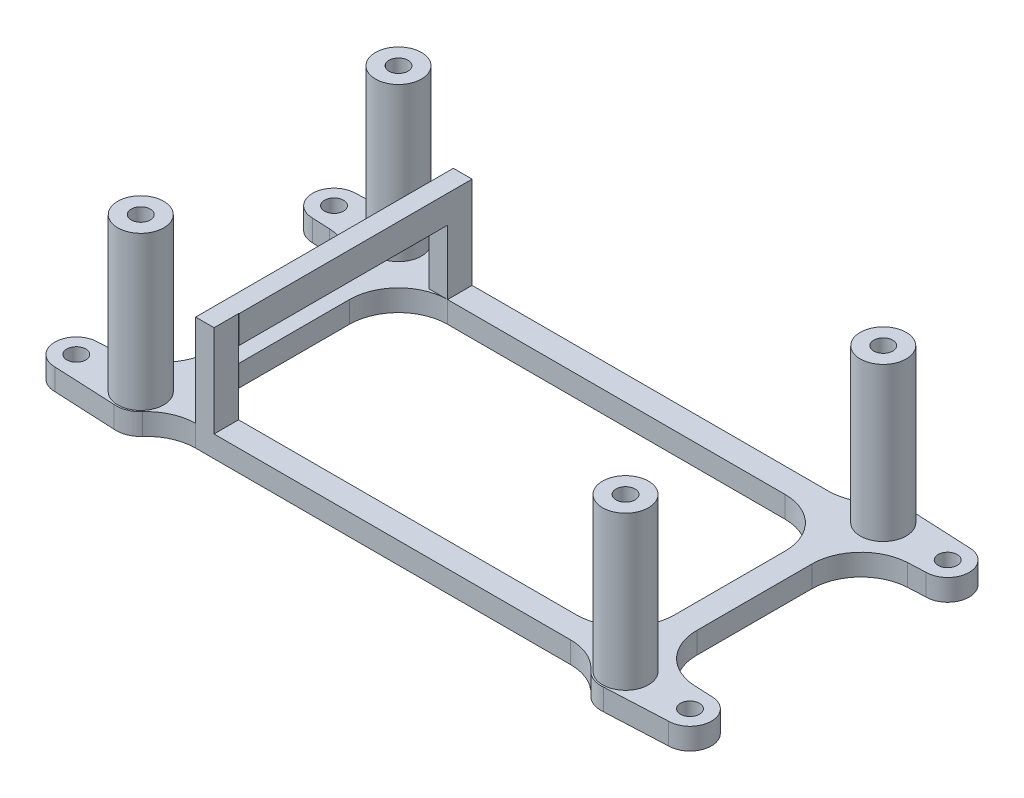
from build123d import *

# Parameters (mm, degrees)
SKETCH10_W              = 71
SKETCH10_H              = 34
BOSS_EXTRUDE6_DEPTH     = 3.5
SKETCH11_R              = 1.55
CUT_EXTRUDE6_DEPTH      = 3.5
SKETCH12_R              = 2.75
CUT_EXTRUDE7_DEPTH      = 3.5
SKETCH13_R              = 3.75
BOSS_EXTRUDE7_DEPTH     = 25
CUT_EXTRUDE8_DEPTH      = 108.597630085
CUT_EXTRUDE8_DEPTH_BACK = 108.597630085
SKETCH14_R              = 1.55
FILLET6_R               = 8
FILLET7_R               = 8
SKETCH16_W              = 3
SKETCH16_H              = 4
SKETCH16_W_2            = 3.05572809
BOSS_EXTRUDE10_DEPTH    = 15
SKETCH18_W              = 3.05572809
SKETCH18_H              = 4.5
BOSS_EXTRUDE11_DEPTH    = 34


with BuildPart() as part:
    # Sketch10 → Boss-Extrude6 (new body)
    with BuildSketch(Plane(origin=(0, 0, 0), x_dir=(1, 0, 0), z_dir=(0, 1, 0))):
        with BuildLine():
            Line((0, -4), (0, -38))
            ThreePointArc((0, -38), (-0.190260598, -38.004527449), (-0.380090498, -38.018099548))
            Line((-0.380090498, -38.018099548), (-10.5, -38.5))
            ThreePointArc((-10.5, -38.5), (-14, -42), (-10.5, -45.5))
            Line((-10.5, -45.5), (-0.380090498, -45.981900452))
            ThreePointArc((-0.380090498, -45.981900452), (2.690691176, -44.959760294), (4, -42))
            Line((4, -42), (75, -42))
            ThreePointArc((75, -42), (76.309308824, -44.959760294), (79.380090498, -45.981900452))
            Line((79.380090498, -45.981900452), (89.5, -45.5))
            ThreePointArc((89.5, -45.5), (93, -42), (89.5, -38.5))
            Line((89.5, -38.5), (79.380090498, -38.018099548))
            ThreePointArc((79.380090498, -38.018099548), (79.190260598, -38.004527449), (79, -38))
            Line((79, -38), (79, -4))
            Line((79, -4), (89.5, -3.5))
            ThreePointArc((89.5, -3.5), (93, 0), (89.5, 3.5))
            Line((89.5, 3.5), (79, 4))
            ThreePointArc((79, 4), (76.171572875, 2.828427125), (75, 0))
            Line((75, 0), (4, 0))
            ThreePointArc((4, 0), (2.828427125, 2.828427125), (0, 4))
            Line((0, 4), (-10.5, 3.5))
            ThreePointArc((-10.5, 3.5), (-14, 0), (-10.5, -3.5))
            Line((-10.5, -3.5), (0, -4))
        make_face()
        with Locations((39.5, -21)):
            Rectangle(SKETCH10_W, SKETCH10_H, mode=Mode.SUBTRACT)
    extrude(amount=BOSS_EXTRUDE6_DEPTH)

    # Sketch11 → Cut-Extrude6 (cut)
    with BuildSketch(Plane(origin=(0, 3.5, 0), x_dir=(1, 0, 0), z_dir=(0, 1, 0))):
        with Locations(Location((0, 0, 0), (0, 0, 270))):
            Circle(SKETCH11_R)
        with Locations(Location((79, 0, 0), (0, 0, 270))):
            Circle(SKETCH11_R)
        with Locations(Location((79, -42, 0), (0, 0, 270))):
            Circle(SKETCH11_R)
        with Locations(Location((0, -42, 0), (0, 0, 270))):
            Circle(SKETCH11_R)
        with Locations(Location((-10.5, -42, 0), (0, 0, 270))):
            Circle(SKETCH11_R)
        with Locations(Location((-10.5, 0, 0), (0, 0, 270))):
            Circle(SKETCH11_R)
        with Locations(Location((89.5, 0, 0), (0, 0, 270))):
            Circle(SKETCH11_R)
        with Locations(Location((89.5, -42, 0), (0, 0, 270))):
            Circle(SKETCH11_R)
    extrude(amount=-CUT_EXTRUDE6_DEPTH, mode=Mode.SUBTRACT)

    # Sketch12 → Cut-Extrude7 (cut)
    with BuildSketch(Plane.XZ):
        with Locations(Location((0, 42, 0), (0, 0, 270))):
            Circle(SKETCH12_R)
        with Locations(Location((79, 42, 0), (0, 0, 270))):
            Circle(SKETCH12_R)
        with Locations(Location((79, 0, 0), (0, 0, 270))):
            Circle(SKETCH12_R)
        with Locations(Location((0, 0, 0), (0, 0, 270))):
            Circle(SKETCH12_R)
    extrude(amount=-CUT_EXTRUDE7_DEPTH, mode=Mode.SUBTRACT)

    # Sketch13 → Boss-Extrude7 (add)
    with BuildSketch(Plane(origin=(0, 3.5, 0), x_dir=(1, 0, 0), z_dir=(0, 1, 0))):
        with Locations(Location((0, 0, 0), (0, 0, 270))):
            Circle(SKETCH13_R)
        with Locations(Location((79, 0, 0), (0, 0, 270))):
            Circle(SKETCH13_R)
        with Locations(Location((79, -42, 0), (0, 0, 270))):
            Circle(SKETCH13_R)
        with Locations(Location((0, -42, 0), (0, 0, 270))):
            Circle(SKETCH13_R)
    extrude(amount=BOSS_EXTRUDE7_DEPTH)

    # Sketch14 → Cut-Extrude8 (cut, two sides: drawn at the far end of the back side and taken through both)
    with BuildSketch(Plane(origin=(0, 28.5, 0), x_dir=(1, 0, 0), z_dir=(0, 1, 0)).offset(-CUT_EXTRUDE8_DEPTH_BACK)):
        with Locations(Location((0, 0, 0), (0, 0, 270))):
            Circle(SKETCH14_R)
        with Locations(Location((79, 0, 0), (0, 0, 270))):
            Circle(SKETCH14_R)
        with Locations(Location((79, -42, 0), (0, 0, 270))):
            Circle(SKETCH14_R)
        with Locations(Location((0, -42, 0), (0, 0, 270))):
            Circle(SKETCH14_R)
    extrude(amount=CUT_EXTRUDE8_DEPTH + CUT_EXTRUDE8_DEPTH_BACK, mode=Mode.SUBTRACT)

    # Fillet6
    fillet6_edges = [part.edges().sort_by_distance(p)[0] for p in [
        (75, 1.75, 0),
        (4, 1.75, 0),
        (4, 1.75, 42),
        (75, 1.75, 42),
        (79, 1.75, 38),
        (79, 1.75, 4),
        (0, 1.75, 38),
        (0, 1.75, 4),
    ]]
    fillet(fillet6_edges, radius=FILLET6_R)

    # Fillet7
    fillet7_edges = [part.edges().sort_by_distance(p)[0] for p in [
        (75, 1.75, 38),
        (4, 1.75, 38),
        (4, 1.75, 4),
        (75, 1.75, 4),
    ]]
    fillet(fillet7_edges, radius=FILLET7_R)

    # Sketch16 → Boss-Extrude10 (add)
    with BuildSketch(Plane(origin=(0, 3.5, 0), x_dir=(1, 0, 0), z_dir=(0, 1, 0))):
        with Locations((10.44427191, -40)):
            Rectangle(SKETCH16_W, SKETCH16_H)
        with Locations((10.472135955, -2)):
            Rectangle(SKETCH16_W_2, SKETCH16_H)
    extrude(amount=BOSS_EXTRUDE10_DEPTH)

    # Sketch18 → Boss-Extrude11 (add)
    with BuildSketch(Plane.XY.offset(4)):
        with Locations((10.472135955, 16.25)):
            Rectangle(SKETCH18_W, SKETCH18_H)
    extrude(amount=BOSS_EXTRUDE11_DEPTH)


solid = part.part
